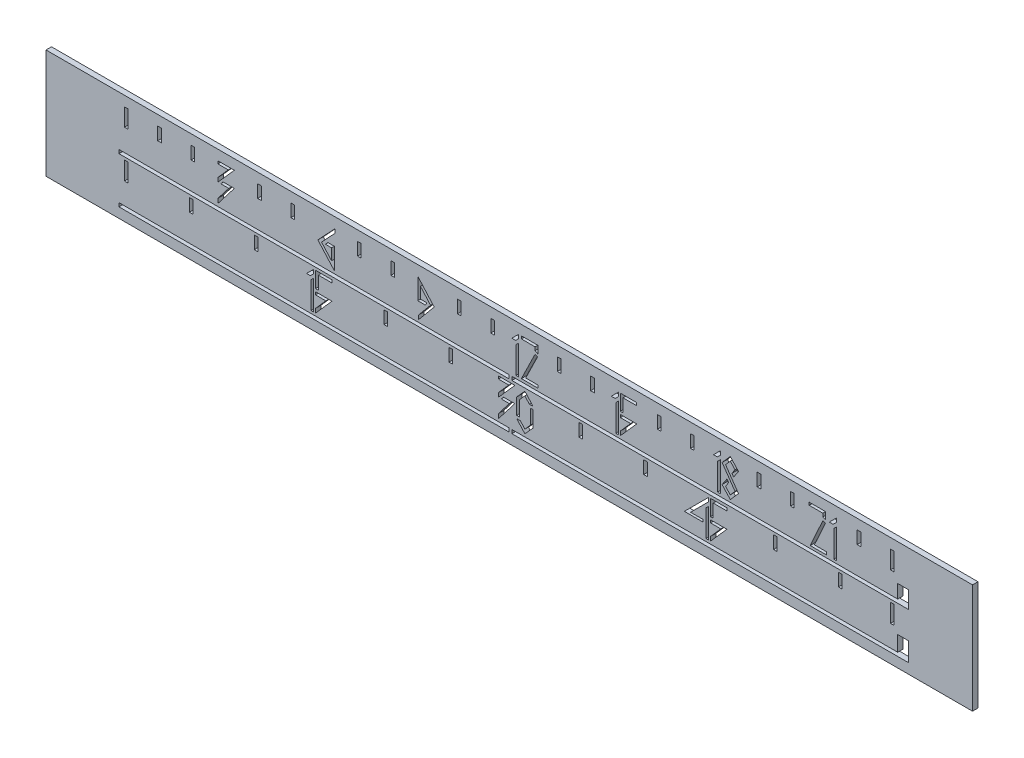
from build123d import *

# Parameters (mm, degrees)
SKETCH1_W             = 500
SKETCH1_H             = 60
BOSS_EXTRUDE1_DEPTH   = 3
HOURS_HAND_HOLE_DEPTH = 3
THREE_CUT_DEPTH       = 10
SIX_CUT_DEPTH         = 10
NINE_CUT_DEPTH        = 10
TWELVE_CUT_DEPTH      = 10
FIFTEEN_CUT_DEPTH     = 10
EIGHTEEN_CUT_DEPTH    = 10
TWENTY_ONE_CUT_DEPTH  = 10
CUT_EXTRUDE9_DEPTH    = 10
CUT_EXTRUDE11_DEPTH   = 10
SKETCH6_W             = 2
SKETCH6_H             = 7
SKETCH6_H_2           = 9.68134765
CUT_EXTRUDE12_DEPTH   = 10
SKETCH7_W             = 2
SKETCH7_H             = 10
SKETCH7_H_2           = 7
CUT_EXTRUDE13_DEPTH   = 10
SKETCH8_W             = 4
SKETCH8_H             = 3
BOSS_EXTRUDE2_DEPTH   = 60
CUT_EXTRUDE14_DEPTH   = 10
CUT_EXTRUDE15_DEPTH   = 10


with BuildPart() as part:
    # Sketch1 → Boss-Extrude1 (new body)
    with BuildSketch(Plane.XY):
        with Locations((250, 30)):
            Rectangle(SKETCH1_W, SKETCH1_H)
    extrude(amount=BOSS_EXTRUDE1_DEPTH)

    # Sketch2 → Hours_hand_Hole (cut)
    with BuildSketch(Plane.XY.offset(3)):
        Polygon((36, 30.75), (195.827863086, 30.75), (197.31023961, 30.75), (249.724616119, 30.75), (249.724616119, 32.75), (193.31023961, 32.75), (191.827863086, 32.75), (36, 32.75), align=None)
        Polygon((465, 30.75), (469, 30.75), (469, 40.146409897), (463, 40.146409897), (463, 32.75), (251.435693126, 32.75), (251.435693126, 30.75), align=None)
    extrude(amount=-HOURS_HAND_HOLE_DEPTH, mode=Mode.SUBTRACT)

    # three → Three_cut (cut)
    with BuildSketch(Plane.XY.offset(3)):
        Polygon((90.28, 54.5), (99.28, 54.5), (90.28, 44.375), (90.28, 46.632798984), (95.939734237, 53), (90.28, 53), align=None)
        Polygon((93.113333333, 45.875), (99.28, 45.875), (90.28, 34.25), (90.28, 36.700286973), (96.221713311, 44.375), (91.78, 44.375), align=None)
    extrude(amount=-THREE_CUT_DEPTH, mode=Mode.SUBTRACT)

    # six → Six_cut (cut)
    with BuildSketch(Plane.XY.offset(3)):
        Polygon((154.58257882, 54.5), (145.06, 44.328013403), (154.06, 34.25), (154.06, 45.828013403), (150.573677814, 45.828013403), (149.169441966, 44.328013403), (152.56, 44.328013403), (152.56, 38.181620857), (147.092379786, 44.304148612), (154.58257882, 52.305153972), align=None)
    extrude(amount=-SIX_CUT_DEPTH, mode=Mode.SUBTRACT)

    # nine → Nine_cut (cut)
    with BuildSketch(Plane.XY.offset(3)):
        Polygon((200.360689731, 34.171672735), (208.84, 44.328013403), (199.84, 54.5), (199.84, 42.828013403), (204.029712573, 42.828013403), (204.834308133, 44.328013403), (201.34, 44.328013403), (201.34, 50.402238338), (206.842387047, 44.183326417), (200.360689731, 36.419684804), align=None)
    extrude(amount=-NINE_CUT_DEPTH, mode=Mode.SUBTRACT)

    # twelve → Twelve_cut (cut)
    with BuildSketch(Plane.XY.offset(3)):
        Polygon((265.64257882, 54.593973195), (265.64257882, 50.530385961), (264.14257882, 51.263572852), (264.14257882, 53.093973195), (256.64257882, 53.093973195), (256.64257882, 54.593973195), align=None)
        Polygon((264.14257882, 49.593973195), (256.64257882, 34.25), (265.64257882, 34.25), (265.64257882, 35.75), (259.045365368, 35.75), (265.49020727, 48.935264185), align=None)
        Polygon((255.12, 54.5), (255.12, 52.406128249), (253.520950317, 50.848734886), (251.371072812, 50.848734886), align=None)
        Polygon((255.12, 34.25), (253.62, 34.25), (253.62, 48.851332508), (255.12, 50.312256499), align=None)
    extrude(amount=-TWELVE_CUT_DEPTH, mode=Mode.SUBTRACT)

    # fifteen → Fifteen_cut (cut)
    with BuildSketch(Plane.XY.offset(3)):
        Polygon((309.901104023, 54.5), (309.901104023, 52.378679656), (308.067508117, 50.545083751), (305.946187774, 50.545083751), align=None)
        Polygon((309.901104023, 34.156026805), (308.401104023, 34.156026805), (308.401104023, 48.757359313), (309.901104023, 50.257359313), align=None)
        Polygon((310.89667875, 34.25), (319.89667875, 44.375), (310.89667875, 44.375), (310.89667875, 42.875), (316.556412987, 42.875), (310.89667875, 36.507798984), align=None)
        Polygon((319.89667875, 54.5), (310.89667875, 54.5), (310.89667875, 45.875), (312.39667875, 45.875), (312.39667875, 53), (319.89667875, 53), align=None)
    extrude(amount=-FIFTEEN_CUT_DEPTH, mode=Mode.SUBTRACT)

    # eighteen → Eighteen_cut (cut)
    with BuildSketch(Plane.XY.offset(3)):
        Polygon((365.681472188, 54.5), (365.681472188, 52.378679656), (364.108429599, 50.805637067), (361.987109255, 50.805637067), align=None)
        Polygon((365.681472188, 34.156026805), (364.181472188, 34.156026805), (364.181472188, 48.757359313), (365.681472188, 50.257359313), align=None)
        Polygon((375.687845374, 49.679389424), (371.170523687, 54.570750056), (366.686633891, 49.462936691), (373.782762707, 39.294510726), (371.171149308, 36.326099439), (368.587845374, 39.123303633), (370.298349983, 41.666435097), (369.377826383, 42.985503045), (366.681472188, 38.976637381), (371.198168254, 34.085954171), (375.686554855, 39.187542885), (368.589662262, 49.357063309), (371.198793875, 52.329249944), (373.781472188, 49.532723173), (372.070967579, 46.989591708), (372.991491179, 45.670523761), align=None)
    extrude(amount=-EIGHTEEN_CUT_DEPTH, mode=Mode.SUBTRACT)

    # twenty_one → Twenty_One_cut (cut)
    with BuildSketch(Plane.XY.offset(3)):
        Polygon((423.46, 54.5), (423.46, 50.465509979), (421.913801892, 51.168960381), (421.913801892, 53), (414.46, 53), (414.46, 54.5), align=None)
        Polygon((421.96, 49.5), (414.982234291, 34.162730845), (423.982234291, 34.162730845), (423.982234291, 35.662730845), (417.312608961, 35.662730845), (423.325339045, 48.878832315), align=None)
        Polygon((429.414916249, 54.5), (429.414916249, 52.378679656), (427.581320344, 50.545083751), (425.46, 50.545083751), align=None)
        Polygon((429.414916249, 34.156026805), (427.914916249, 34.156026805), (427.914916249, 48.757359313), (429.414916249, 50.257359313), align=None)
    extrude(amount=-TWENTY_ONE_CUT_DEPTH, mode=Mode.SUBTRACT)

    # Sketch4 → Cut-Extrude9 (cut)
    with BuildSketch(Plane.XY.offset(3)):
        Polygon((142.779661017, 29.25), (142.779661017, 27.128679656), (140.946065112, 25.295083751), (138.824744768, 25.295083751), align=None)
        Polygon((142.779661017, 8.906026805), (141.279661017, 8.906026805), (141.279661017, 23.507359313), (142.779661017, 25.007359313), align=None)
        Polygon((143.779661017, 8.906026805), (152.779661017, 19.078013403), (143.779661017, 19.078013403), (143.779661017, 17.578013403), (149.449640704, 17.578013403), (143.779661017, 11.169684804), align=None)
        Polygon((152.779661017, 29.25), (143.779661017, 29.25), (143.779661017, 20.578013403), (145.279661017, 20.578013403), (145.279661017, 27.75), (152.779661017, 27.75), align=None)
    extrude(amount=-CUT_EXTRUDE9_DEPTH, mode=Mode.SUBTRACT)

    # forty_five → Cut-Extrude11 (cut)
    with BuildSketch(Plane.XY.offset(3)):
        Polygon((359.338983051, 29.25), (359.338983051, 27.128679656), (349.410221969, 17.199918575), (356.338983051, 17.199918575), (356.338983051, 15.915440526), (346.004423577, 15.915440526), align=None)
        Polygon((359.338983051, 8.906026805), (357.838983051, 8.906026805), (357.838983051, 23.507359313), (359.338983051, 25.007359313), align=None)
        Polygon((360.338983051, 8.906026805), (369.338983051, 19.078013403), (360.338983051, 19.078013403), (360.338983051, 17.578013403), (366.008962738, 17.578013403), (360.338983051, 11.169684804), align=None)
        Polygon((369.338983051, 29.25), (360.338983051, 29.25), (360.338983051, 20.578013403), (361.838983051, 20.578013403), (361.838983051, 27.75), (369.338983051, 27.75), align=None)
    extrude(amount=-CUT_EXTRUDE11_DEPTH, mode=Mode.SUBTRACT)

    # Sketch6 → Cut-Extrude12 (cut)
    with BuildSketch(Plane.XY.offset(3)):
        with Locations((441.72, 51)):
            Rectangle(SKETCH6_W, SKETCH6_H)
        with Locations((405.2, 51)):
            Rectangle(SKETCH6_W, SKETCH6_H)
        with Locations((386.94, 51)):
            Rectangle(SKETCH6_W, SKETCH6_H)
        with Locations((350.42, 51)):
            Rectangle(SKETCH6_W, SKETCH6_H)
        with Locations((332.16, 51)):
            Rectangle(SKETCH6_W, SKETCH6_H)
        with Locations((295.64, 51)):
            Rectangle(SKETCH6_W, SKETCH6_H)
        with Locations((277.38, 51)):
            Rectangle(SKETCH6_W, SKETCH6_H)
        with Locations((240.86, 51)):
            Rectangle(SKETCH6_W, SKETCH6_H)
        with Locations((222.6, 51)):
            Rectangle(SKETCH6_W, SKETCH6_H)
        with Locations((186.08, 51)):
            Rectangle(SKETCH6_W, SKETCH6_H)
        with Locations((167.82, 51)):
            Rectangle(SKETCH6_W, SKETCH6_H)
        with Locations((131.3, 51)):
            Rectangle(SKETCH6_W, SKETCH6_H)
        with Locations((113.04, 51)):
            Rectangle(SKETCH6_W, SKETCH6_H)
        with Locations((76.52, 51)):
            Rectangle(SKETCH6_W, SKETCH6_H)
        with Locations((58.26, 51)):
            Rectangle(SKETCH6_W, SKETCH6_H)
        Polygon((460.99810076, 44.593973195), (460.99810076, 54.561602536), (458.99810076, 54.5), (458.99810076, 44.593973195), align=None)
        with Locations((40, 49.659326175)):
            Rectangle(SKETCH6_W, SKETCH6_H_2)
    extrude(amount=-CUT_EXTRUDE12_DEPTH, mode=Mode.SUBTRACT)

    # Sketch7 → Cut-Extrude13 (cut)
    with BuildSketch(Plane.XY.offset(3)):
        with Locations((40, 24.25)):
            Rectangle(SKETCH7_W, SKETCH7_H)
        with Locations((75.593220339, 25.75)):
            Rectangle(SKETCH7_W, SKETCH7_H_2)
        with Locations((111.183220339, 25.75)):
            Rectangle(SKETCH7_W, SKETCH7_H_2)
        with Locations((460, 24.25)):
            Rectangle(SKETCH7_W, SKETCH7_H)
        with Locations((182.363220339, 25.75)):
            Rectangle(SKETCH7_W, SKETCH7_H_2)
        with Locations((217.953220339, 25.75)):
            Rectangle(SKETCH7_W, SKETCH7_H_2)
        with Locations((289.133220339, 25.75)):
            Rectangle(SKETCH7_W, SKETCH7_H_2)
        with Locations((324.723220339, 25.75)):
            Rectangle(SKETCH7_W, SKETCH7_H_2)
        with Locations((395.903220339, 25.75)):
            Rectangle(SKETCH7_W, SKETCH7_H_2)
        with Locations((431.493220339, 25.75)):
            Rectangle(SKETCH7_W, SKETCH7_H_2)
    extrude(amount=-CUT_EXTRUDE13_DEPTH, mode=Mode.SUBTRACT)

    # Sketch8 → Boss-Extrude2 (add)
    with BuildSketch(Plane(origin=(0, 60, 0), x_dir=(1, 0, 0), z_dir=(0, 1, 0))):
        with Locations((-2, -1.5)):
            Rectangle(SKETCH8_W, SKETCH8_H)
        with Locations((502, -1.5)):
            Rectangle(SKETCH8_W, SKETCH8_H)
    extrude(amount=-BOSS_EXTRUDE2_DEPTH)

    # Sketch9 → Cut-Extrude14 (cut)
    with BuildSketch(Plane.XY.offset(3)):
        Polygon((244.059322034, 29.25), (253.059322034, 29.25), (244.059322034, 19.078013403), (244.059322034, 21.341671402), (249.729301721, 27.75), (244.059322034, 27.75), align=None)
        Polygon((246.886496413, 20.578013403), (253.059322034, 20.578013403), (244.059322034, 8.906026805), (244.059322034, 11.362510692), (250.008568447, 19.078013403), (245.559322034, 19.078013403), align=None)
        Polygon((258.559322034, 29.25), (254.059322034, 24.25), (254.059322034, 15.5), (255.559322034, 15.5), (255.559322034, 23.674395992), (258.559322034, 27.007729325), (261.041278427, 24.25), (263.059322034, 24.25), align=None)
        Polygon((258.559322034, 9), (254.059322034, 14), (256.077365641, 14), (258.559322034, 11.242270675), (261.559322034, 14.575604008), (261.559322034, 22.75), (263.059322034, 22.75), (263.059322034, 14), align=None)
    extrude(amount=-CUT_EXTRUDE14_DEPTH, mode=Mode.SUBTRACT)

    # Sketch10 → Cut-Extrude15 (cut)
    with BuildSketch(Plane.XY.offset(3)):
        Polygon((36, 5.5), (195.827863086, 5.5), (197.31023961, 5.5), (249.724616119, 5.5), (249.724616119, 7.5), (193.31023961, 7.5), (191.827863086, 7.5), (36, 7.5), align=None)
        Polygon((465, 5.5), (469, 5.5), (469, 15.90035273), (463, 15.90035273), (463, 7.5), (251.435693126, 7.5), (251.435693126, 5.5), align=None)
    extrude(amount=-CUT_EXTRUDE15_DEPTH, mode=Mode.SUBTRACT)


solid = part.part
